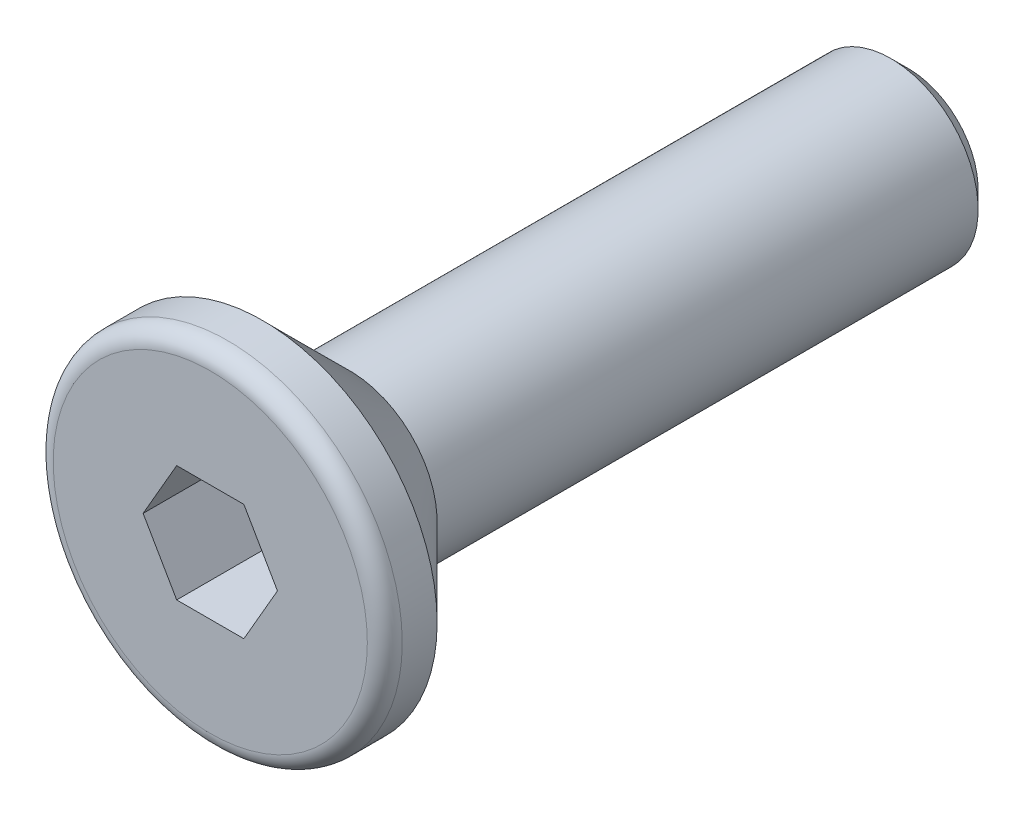
from build123d import *

# Parameters (mm, degrees)
CUT_EXTRUDE_1_DEPTH = 1.5
FILLET_1_R          = 0.3


with BuildPart() as part:
    # 草图1 → 旋转1 (revolve)
    with BuildSketch(Plane(origin=(0, 0, 0), x_dir=(0, 0, -1), z_dir=(1, 0, 0)), mode=Mode.PRIVATE) as revolve_1_sk:
        Polygon((-6, 0), (-6, 3), (-5.1, 3), (-3.6, 1.5), (5.7, 1.5), (6, 1.2), (6, 0), align=None)
    revolve(revolve_1_sk.sketch.rotate(Axis((0, 0, -6), (0, 0, 1)), 90), axis=Axis((0, 0, -6), (0, 0, 1)))

    # 草图2 → 切除-拉伸1 (cut)
    with BuildSketch(Plane.XY.offset(6)):
        Polygon((1.154700538, 0), (0.577350269, 1), (-0.577350269, 1), (-1.154700538, 0), (-0.577350269, -1), (0.577350269, -1), align=None)
    extrude(amount=-CUT_EXTRUDE_1_DEPTH, mode=Mode.SUBTRACT)

    # 圆角1
    fillet_1_edges = [part.edges().sort_by_distance(p)[0] for p in [
        (3, 0, 6),
    ]]
    fillet(fillet_1_edges, radius=FILLET_1_R)


solid = part.part
